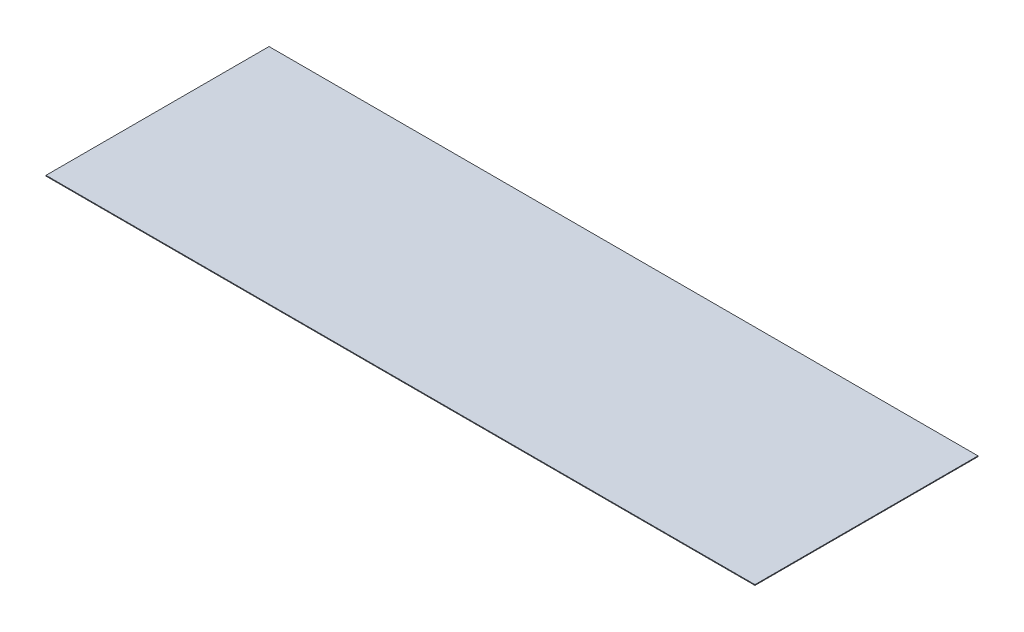
from build123d import *

# Parameters (mm, degrees)
SKETCH1_W   = 1920
SKETCH1_H   = 604
THICKEN1_T1 = 2


with BuildPart() as body_1:
    # Sketch1 → Surface-Plane1: a flat surface bounded by the sketch
    with BuildSketch(Plane(origin=(0, 0, 0), x_dir=(1, 0, 0), z_dir=(0, 1, 0)), mode=Mode.PRIVATE) as surface_plane1_1_region:
        Rectangle(SKETCH1_W, SKETCH1_H)
    surface_plane1_1 = surface_plane1_1_region.sketch.faces()[0]
    add(Solid.thicken(surface_plane1_1, THICKEN1_T1))


solid = body_1.part
